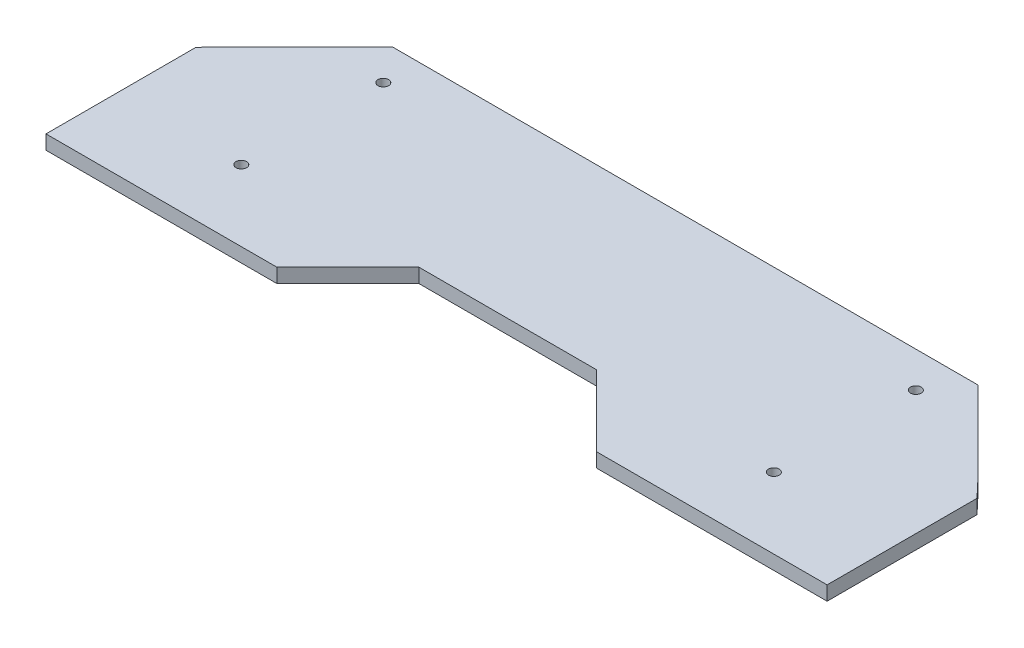
from build123d import *

# Parameters (mm, degrees)
EXTRUDE_1_DEPTH     = 4
SKETCH_2_R          = 1.5
CUT_EXTRUDE_1_DEPTH = 4
SKETCH_3_W          = 10
SKETCH_3_H          = 69.678883607
SKETCH_3_H_2        = 93.047687854
CUT_EXTRUDE_2_DEPTH = 4
CUT_EXTRUDE_3_DEPTH = 4
EXTRUDE_2_DEPTH     = 4


with BuildPart() as part:
    # 草图1 → 凸台-拉伸1 (new body)
    with BuildSketch(Plane(origin=(0, 0, 0), x_dir=(1, 0, 0), z_dir=(0, 1, 0))):
        Polygon((-67.5, -35), (-47.5, -15), (2.5, -15), (22.5, -35), (92.5, -35), (92.5, 15), (72.5, 35), (-117.5, 35), (-137.5, 15), (-137.5, -35), align=None)
    extrude(amount=EXTRUDE_1_DEPTH)

    # 草图2 → 切除-拉伸1 (cut)
    with BuildSketch(Plane(origin=(0, 4, 0), x_dir=(1, 0, 0), z_dir=(0, 1, 0))):
        with Locations(Location((-97.5, -15, 0), (0, 0, 270))):
            Circle(SKETCH_2_R)
        with Locations(Location((-97.5, 25, 0), (0, 0, 270))):
            Circle(SKETCH_2_R)
        with Locations(Location((52.5, 25, 0), (0, 0, 90))):
            Circle(SKETCH_2_R)
        with Locations(Location((52.5, -15, 0), (0, 0, 90))):
            Circle(SKETCH_2_R)
    extrude(amount=-CUT_EXTRUDE_1_DEPTH, mode=Mode.SUBTRACT)

    # 草图3 → 切除-拉伸2 (cut)
    with BuildSketch(Plane(origin=(0, 4, 0), x_dir=(1, 0, 0), z_dir=(0, 1, 0))):
        with Locations((-132.5, -0.160558196)):
            Rectangle(SKETCH_3_W, SKETCH_3_H)
        with Locations((87.5, 11.523843927)):
            Rectangle(SKETCH_3_W, SKETCH_3_H_2)
    extrude(amount=-CUT_EXTRUDE_2_DEPTH, mode=Mode.SUBTRACT)

    # 草图4 → 切除-拉伸3 (cut)
    with BuildSketch(Plane(origin=(0, 4, 0), x_dir=(1, 0, 0), z_dir=(0, 1, 0))):
        Polygon((-127.5, 12.5), (-92.197077218, 47.802922782), (-150.178982695, 47.802922782), align=None)
        Polygon((82.5, 12.5), (37.005283765, 57.994716235), (96.544114713, 56.205234398), align=None)
    extrude(amount=-CUT_EXTRUDE_3_DEPTH, mode=Mode.SUBTRACT)

    # 草图5 → 凸台-拉伸2 (add)
    with BuildSketch(Plane(origin=(0, 4, 0), x_dir=(1, 0, 0), z_dir=(0, 1, 0))):
        Polygon((-127.5, 12.5), (-132.5, 7.215634365), (-132.5, -35), (-127.5, -35), align=None)
        Polygon((82.5, -35), (82.5, 12.5), (87.5, 7.215634365), (87.5, -35), align=None)
    extrude(amount=-EXTRUDE_2_DEPTH)


solid = part.part
